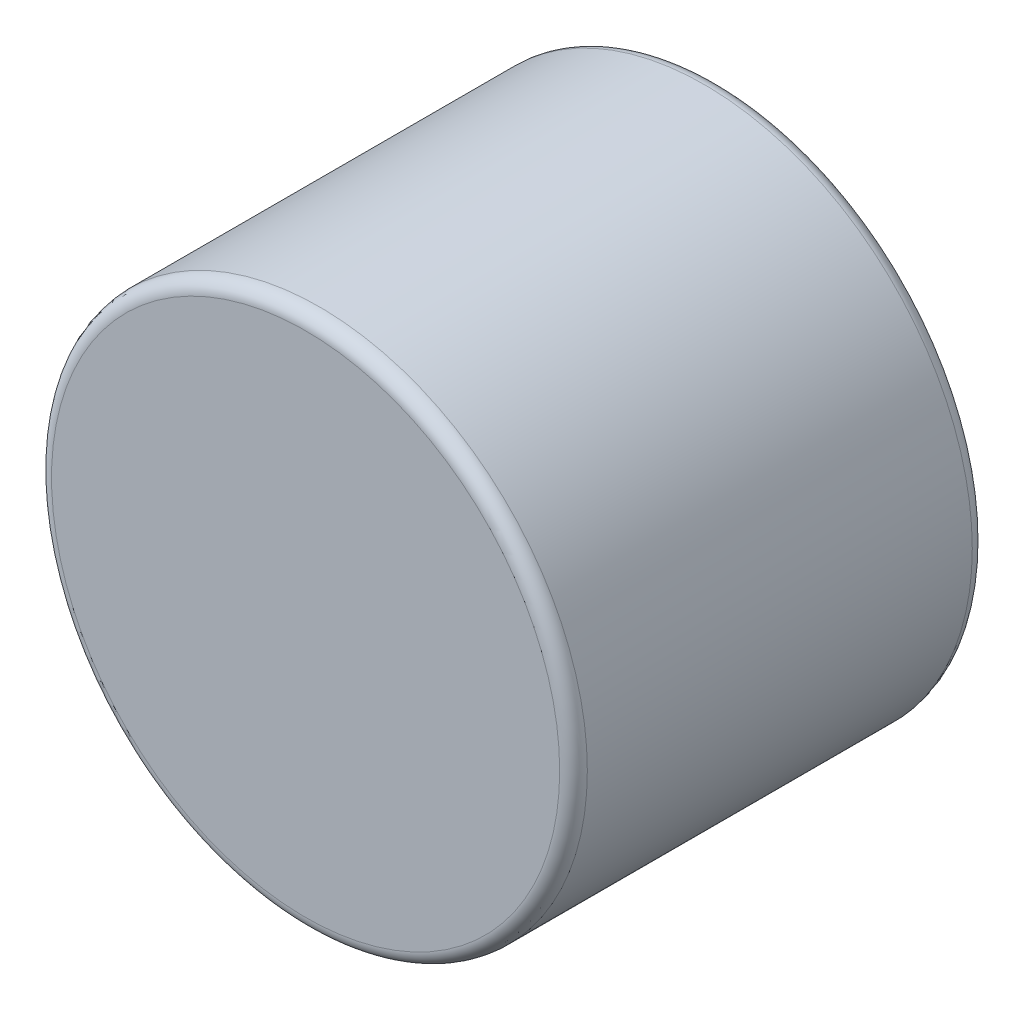
from build123d import *

# Parameters (mm, degrees)
SKETCH1_R           = 49.2125
BOSS_EXTRUDE1_DEPTH = 75.7936
FILLET1_R           = 2.54


with BuildPart() as part:
    # Sketch1 → Boss-Extrude1 (new body)
    with BuildSketch(Plane.XY):
        Circle(SKETCH1_R)
    extrude(amount=BOSS_EXTRUDE1_DEPTH)

    # Fillet1
    fillet1_edges = [part.edges().sort_by_distance(p)[0] for p in [
        (-49.2125, 0, 0),
        (-49.2125, 0, 75.7936),
    ]]
    fillet(fillet1_edges, radius=FILLET1_R)


solid = part.part
